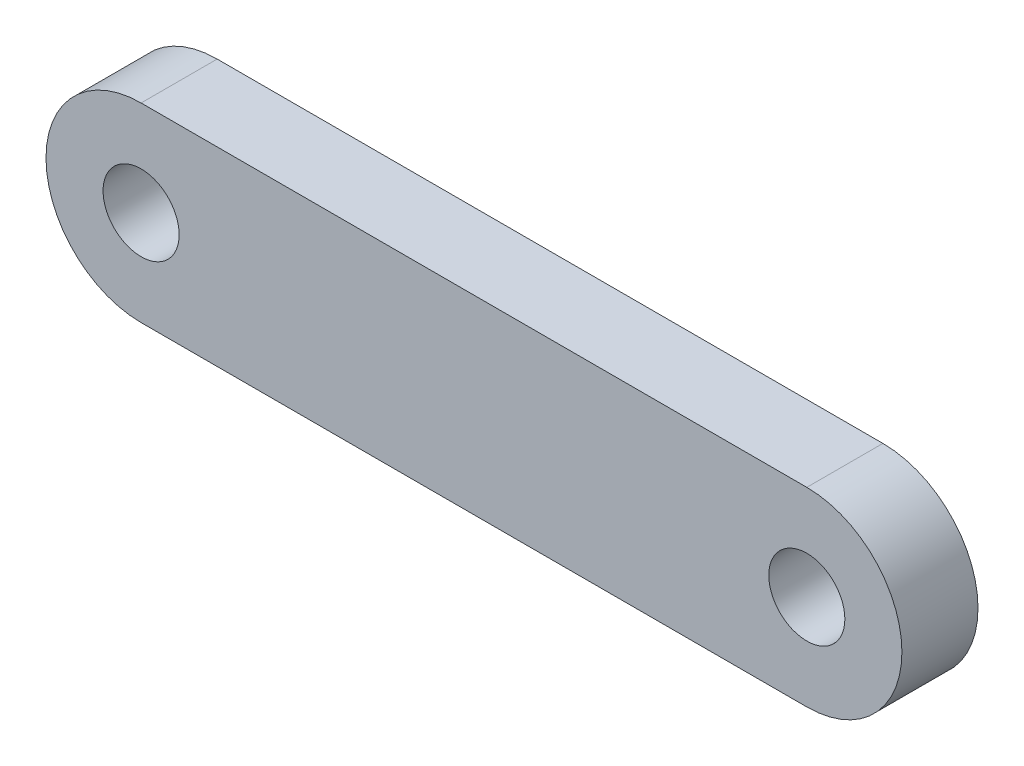
from build123d import *

# Parameters (mm, degrees)
SKETCH1_R           = 2
BOSS_EXTRUDE1_DEPTH = 4


with BuildPart() as part:
    # Sketch1 → Boss-Extrude1 (new body)
    with BuildSketch(Plane.XY):
        with BuildLine():
            Line((-35, 5), (0, 5))
            ThreePointArc((0, 5), (5, 0), (0, -5))
            Line((0, -5), (-35, -5))
            ThreePointArc((-35, -5), (-40, 0), (-35, 5))
        make_face()
        with Locations((-35, 0)):
            Circle(SKETCH1_R, mode=Mode.SUBTRACT)
        Circle(SKETCH1_R, mode=Mode.SUBTRACT)
    extrude(amount=BOSS_EXTRUDE1_DEPTH)


solid = part.part
